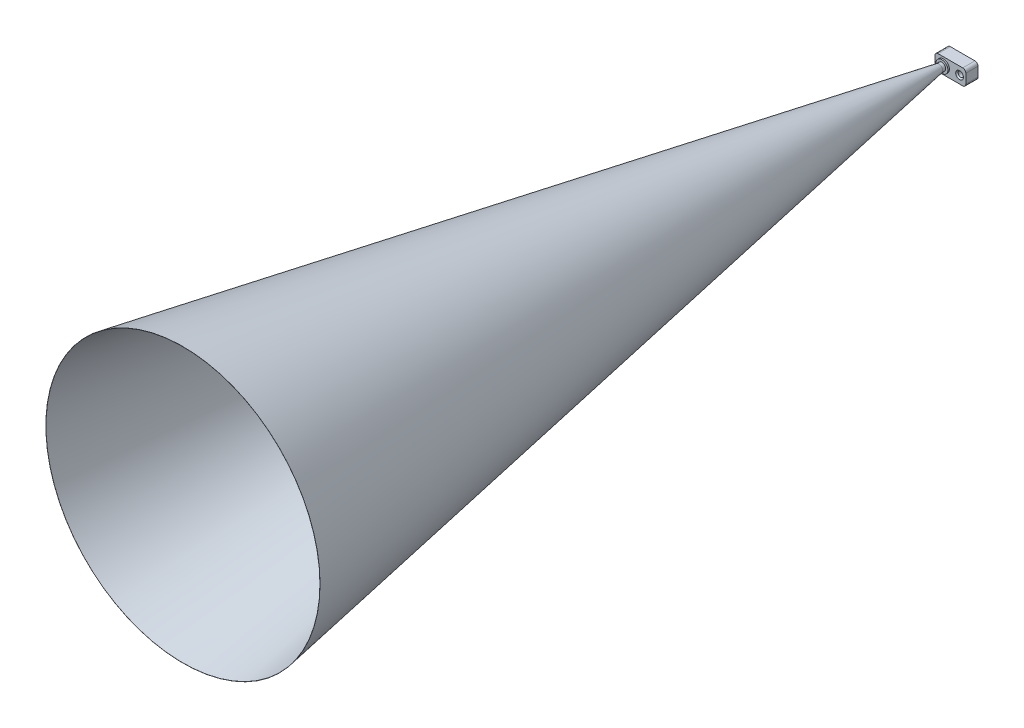
from build123d import *

# Parameters (mm, degrees)
SKETCH1_W                     = 20.066
SKETCH1_H                     = 10.16
BOSS_EXTRUDE1_DEPTH           = 7.9502
SKETCH2_R                     = 3.8862
BOSS_EXTRUDE2_DEPTH           = 0.9906
SKETCH3_R                     = 2.4765
BOSS_EXTRUDE3_DEPTH           = 4.2164
CSK_FOR_M3_SFHCS1_D           = 3.4
CSK_FOR_M3_SFHCS1_CSINK_D     = 5
CSK_FOR_M3_SFHCS1_CSINK_ANGLE = 90
FILLET1_R                     = 2.286
FILLET2_R                     = 2


with BuildPart() as part:
    # Sketch1 → Boss-Extrude1 (new body)
    with BuildSketch(Plane.XY):
        with Locations((10.033, 5.08)):
            Rectangle(SKETCH1_W, SKETCH1_H)
    extrude(amount=BOSS_EXTRUDE1_DEPTH)

    # Sketch2 → Boss-Extrude2 (add)
    with BuildSketch(Plane.XY.offset(7.9502)):
        with Locations((5.5, 5.08)):
            Circle(SKETCH2_R)
    extrude(amount=BOSS_EXTRUDE2_DEPTH)

    # Sketch3 → Boss-Extrude3 (add)
    with BuildSketch(Plane.XY.offset(8.9408)):
        with Locations((5.5, 5.08)):
            Circle(SKETCH3_R)
    extrude(amount=BOSS_EXTRUDE3_DEPTH)

    # CSK for M3 SFHCS1 (through all)
    with Locations(Plane.XY.offset(7.9502)):
        with Locations((16, 5.08)):
            CounterSinkHole(CSK_FOR_M3_SFHCS1_D / 2, CSK_FOR_M3_SFHCS1_CSINK_D / 2, counter_sink_angle=CSK_FOR_M3_SFHCS1_CSINK_ANGLE)

    # Fillet1
    fillet1_edges = [part.edges().sort_by_distance(p)[0] for p in [
        (3.0235, 5.08, 13.1572),
    ]]
    fillet(fillet1_edges, radius=FILLET1_R)

    # Fillet2
    fillet2_edges = [part.edges().sort_by_distance(p)[0] for p in [
        (0, 10.16, 3.9751),
        (20.066, 10.16, 3.9751),
        (20.066, 0, 3.9751),
        (0, 0, 3.9751),
    ]]
    fillet(fillet2_edges, radius=FILLET2_R)


with BuildPart() as body_2:
    # Sketch7 → Reciving View (revolve)
    with BuildSketch(Plane(origin=(0, 5.08, 0), x_dir=(1, 0, 0), z_dir=(0, 1, 0))):
        Polygon((7.9765, -10.8712), (94.800588833, -503.275076506), (94.730036927, -503.275076506), (7.905948093, -10.8712), align=None)
    revolve(axis=Axis((5.5, 5.08, 13.1572), (0, 0, 1)))


solid = Compound([part.part, body_2.part])
